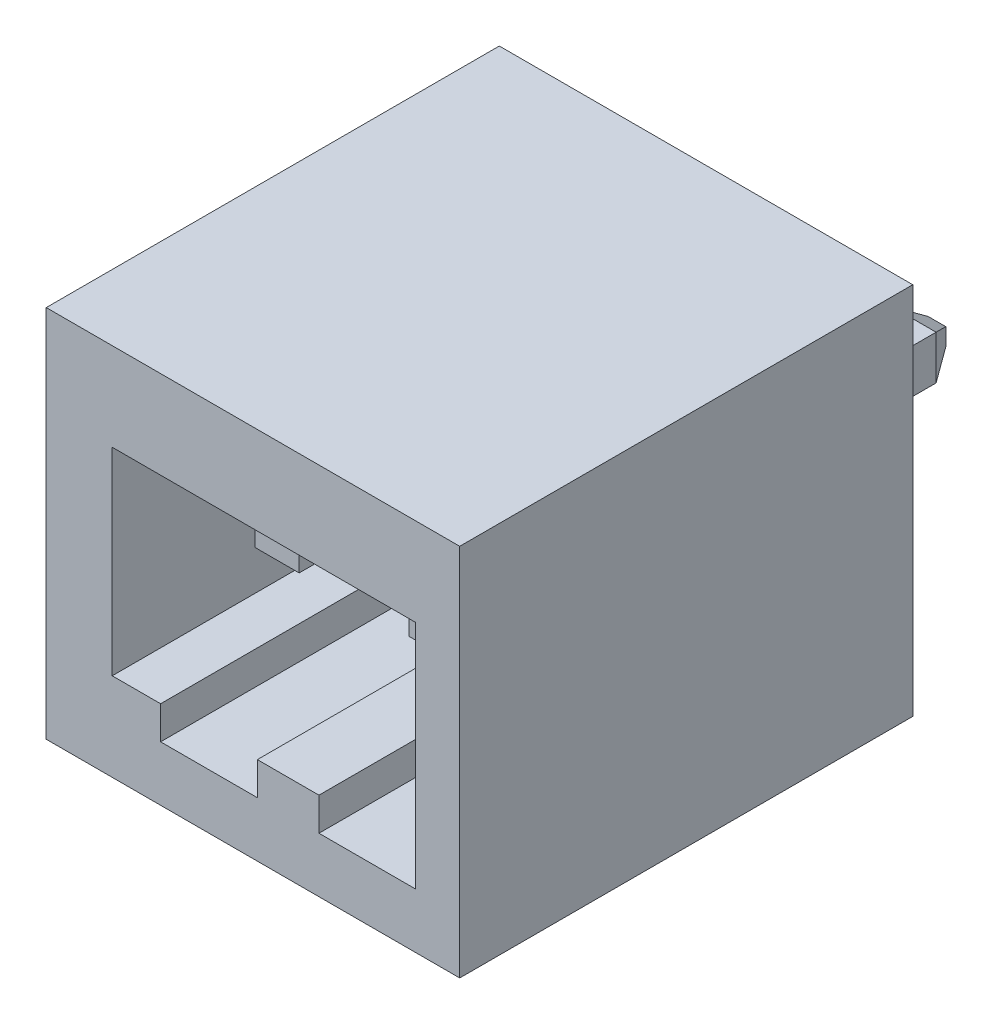
from build123d import *

# Parameters (mm, degrees)
EXTRUDE_1_DEPTH            = 8
EXTRUDE_1_DEPTH_BACK       = 3.5
SKETCH_1_W                 = 1
SKETCH_1_H                 = 1
CHAMFER_1_SIZE             = 0.3
CHAMFER_1_SIZE2            = 0.519615242
PATTERN_LINEAR_1_COUNT     = 2
PATTERN_LINEAR_1_PITCH     = 3.5
SKETCH_3_W                 = 9.4
SKETCH_3_H                 = 8.5
EXTRUDE_2_DEPTH            = 10.3
SHELL_1_T                  = -2
SHELL_1_THICKNESS_2_FACE_W = 8.3
SHELL_1_THICKNESS_2_FACE_H = 4.5
SHELL_1_THICKNESS_2_DEPTH  = 0.5
SHELL_1_THICKNESS_3_FACE_W = 4.5
SHELL_1_THICKNESS_3_FACE_H = 8.3
SHELL_1_THICKNESS_3_DEPTH  = 1
SHELL_1_THICKNESS_4_FACE_W = 6.9
SHELL_1_THICKNESS_4_FACE_H = 4.5
SHELL_1_THICKNESS_4_DEPTH  = 0.5
SKETCH_4_W                 = 2.2
SKETCH_4_H                 = 0.75
CUT_EXTRUDE_1_DEPTH        = 8.8


with BuildPart() as part:
    # Эскиз1 → Бобышка-Вытянуть1 (new, two sides: drawn at the far end of the back side and taken through both)
    with BuildSketch(Plane.XY.offset(-EXTRUDE_1_DEPTH_BACK)):
        with Locations((-1.75, 0)):
            Rectangle(SKETCH_1_W, SKETCH_1_H)
    extrude(amount=EXTRUDE_1_DEPTH + EXTRUDE_1_DEPTH_BACK)

    # Фаска1
    chamfer_1_edges = [part.edges().sort_by_distance(p)[0] for p in [
        (-2.25, 0, -3.5),
        (-1.75, -0.5, -3.5),
        (-1.25, 0, -3.5),
        (-1.75, 0.5, -3.5),
    ]]
    chamfer_1_side = [part.faces().sort_by_distance(p)[0] for p in [
        (-1.75, 0, -3.5),
    ]]
    chamfer(chamfer_1_edges, length=CHAMFER_1_SIZE, length2=CHAMFER_1_SIZE2, reference=chamfer_1_side[0])


with BuildPart() as pattern_linear_1_1:
    # Линейный массив1: pattern copy
    add(part.part.moved(Location(Vector(1, 0, 0) * (1 * PATTERN_LINEAR_1_PITCH))))


with BuildPart() as body_3:
    # Эскиз3 → Бобышка-Вытянуть2 (new body)
    with BuildSketch(Plane.XY):
        with Locations((0, -0.1)):
            Rectangle(SKETCH_3_W, SKETCH_3_H)
    extrude(amount=EXTRUDE_2_DEPTH)

    # Оболочка1
    shell_1_openings = [body_3.faces().sort_by_distance(p)[0] for p in [
        (0, -0.1, 10.3),
    ]]
    offset(amount=SHELL_1_T, openings=shell_1_openings, kind=Kind.INTERSECTION)

    # Оболочка1 thickness 2 face (on inner face of the shell) → Оболочка1 thickness 2 (cut)
    with BuildSketch(Plane(origin=(-2.7, -0.1, 6.15), x_dir=(0, 0, -1), z_dir=(-1, 0, 0))):
        Rectangle(SHELL_1_THICKNESS_2_FACE_W, SHELL_1_THICKNESS_2_FACE_H)
    extrude(amount=SHELL_1_THICKNESS_2_DEPTH, mode=Mode.SUBTRACT)

    # Оболочка1 thickness 3 face (on inner face of the shell) → Оболочка1 thickness 3 (cut)
    with BuildSketch(Plane(origin=(2.7, -0.1, 6.15), x_dir=(0, 1, 0), z_dir=(1, 0, 0))):
        Rectangle(SHELL_1_THICKNESS_3_FACE_W, SHELL_1_THICKNESS_3_FACE_H)
    extrude(amount=SHELL_1_THICKNESS_3_DEPTH, mode=Mode.SUBTRACT)

    # Оболочка1 thickness 4 face (on inner face of the shell) → Оболочка1 thickness 4 (cut)
    with BuildSketch(Plane(origin=(0.25, -0.1, 2), x_dir=(-1, 0, 0), z_dir=(0, 0, -1))):
        Rectangle(SHELL_1_THICKNESS_4_FACE_W, SHELL_1_THICKNESS_4_FACE_H)
    extrude(amount=SHELL_1_THICKNESS_4_DEPTH, mode=Mode.SUBTRACT)

    # Эскиз4 → Вырез-Вытянуть1 (cut)
    with BuildSketch(Plane.XY.offset(10.3)):
        with Locations((-1, -2.725)):
            Rectangle(SKETCH_4_W, SKETCH_4_H)
        with Locations((2.6, -2.725)):
            Rectangle(SKETCH_4_W, SKETCH_4_H)
    extrude(amount=-CUT_EXTRUDE_1_DEPTH, mode=Mode.SUBTRACT)


solid = Compound([part.part, pattern_linear_1_1.part, body_3.part])
